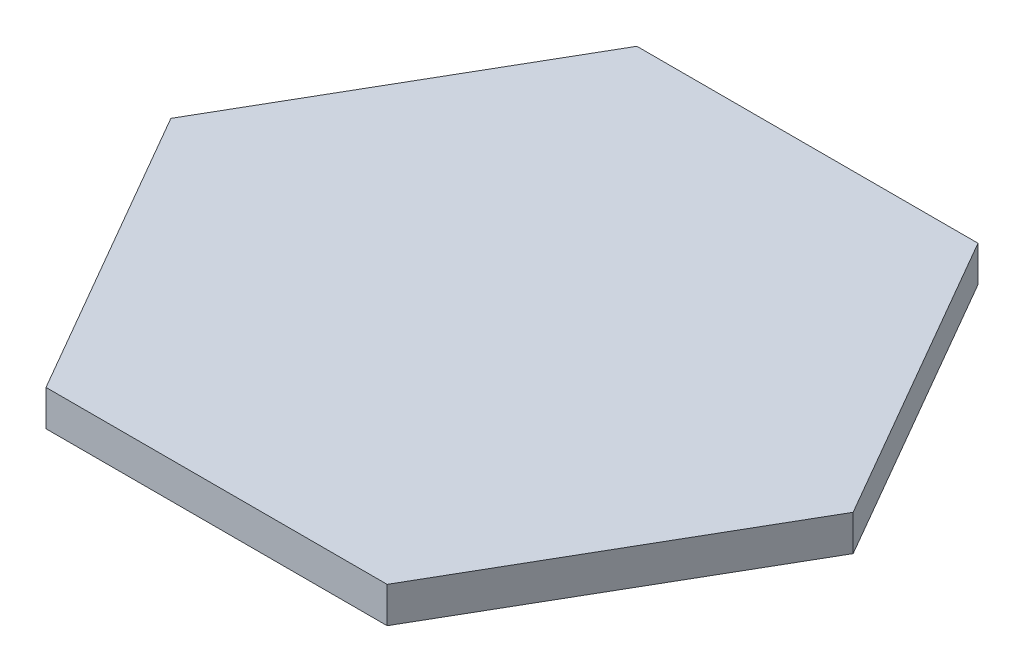
from build123d import *

# Parameters (mm, degrees)
BOSS_EXTRUDE1_DEPTH = 7.5


with BuildPart() as part:
    # Sketch1 → Boss-Extrude1 (new body)
    with BuildSketch(Plane(origin=(0, 0, 0), x_dir=(1, 0, 0), z_dir=(0, 1, 0))):
        Polygon((71.4, 0), (35.7, 61.83421383), (-35.7, 61.83421383), (-71.4, 0), (-35.7, -61.83421383), (35.7, -61.83421383), align=None)
    extrude(amount=BOSS_EXTRUDE1_DEPTH)


solid = part.part
